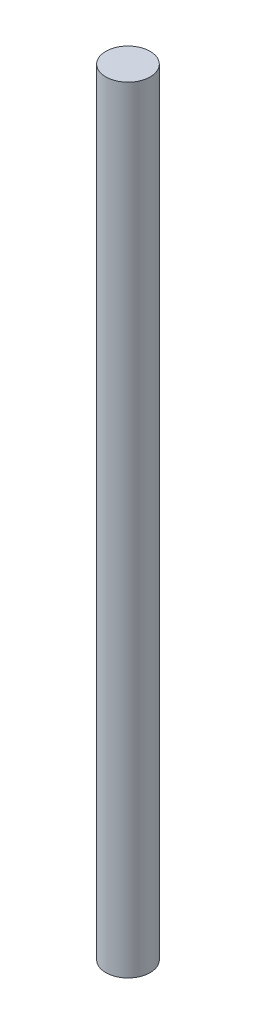
from build123d import *

# Parameters (mm, degrees)
SKETCH1_R           = 2
BOSS_EXTRUDE1_DEPTH = 70


with BuildPart() as part:
    # Sketch1 → Boss-Extrude1 (new body)
    with BuildSketch(Plane(origin=(0, 0, 0), x_dir=(1, 0, 0), z_dir=(0, 1, 0))):
        with Locations(Location((0, 0, 0), (0, 0, 270))):
            Circle(SKETCH1_R)
    extrude(amount=BOSS_EXTRUDE1_DEPTH)


solid = part.part
